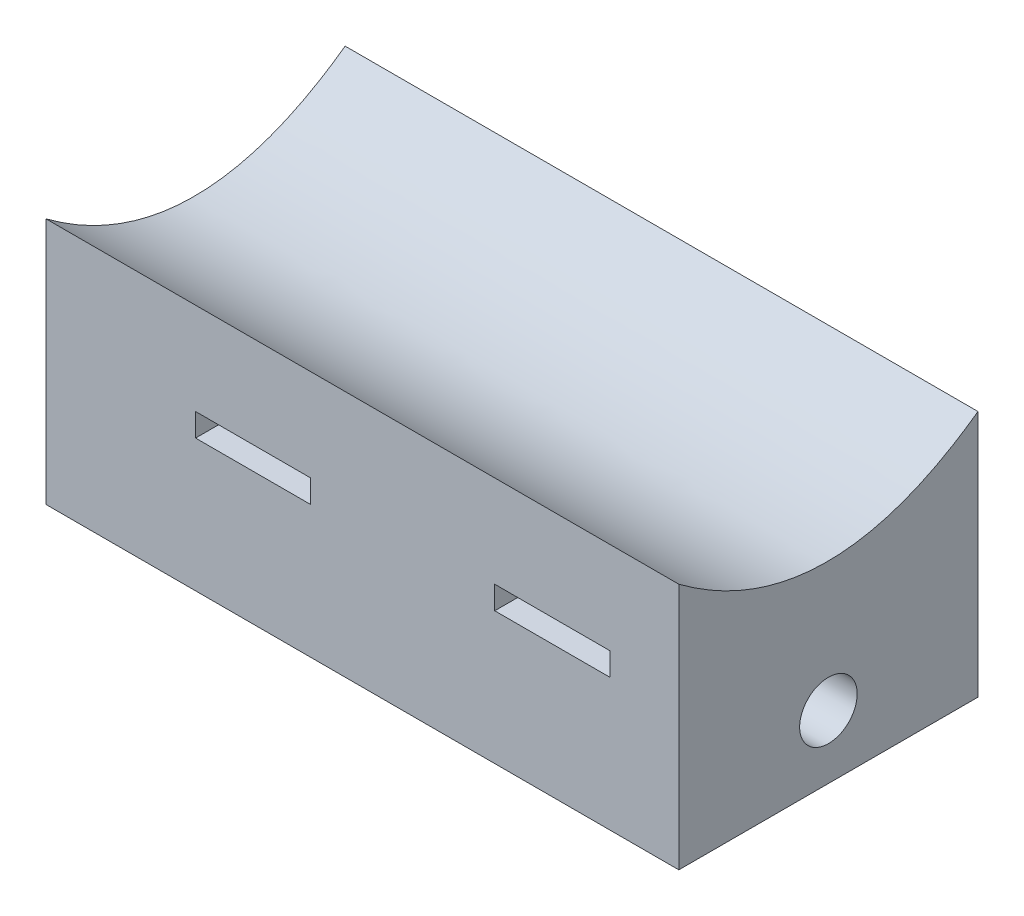
from build123d import *

# Parameters (mm, degrees)
ESQUISSE1_W             = 55
ESQUISSE1_H             = 26
BOSS_EXTRU_1_DEPTH      = 25
ENL_V_MAT_EXTRU_1_REACH = 49.007
ESQUISSE2_W             = 10
ESQUISSE2_H             = 2
ENL_V_MAT_EXTRU_5_REACH = 64.857
ESQUISSE5_R             = 2.5
ESQUISSE5_W             = 26
ESQUISSE5_H             = 3.5


with BuildPart() as part:
    # Esquisse1 → Boss.-Extru.1 (new body)
    with BuildSketch(Plane(origin=(0, 0, 0), x_dir=(1, 0, 0), z_dir=(0, 1, 0))):
        with Locations((2.643338954, -4.351180438)):
            Rectangle(ESQUISSE1_W, ESQUISSE1_H)
    extrude(amount=BOSS_EXTRU_1_DEPTH)

    # Esquisse2 → Enlèv. mat.-Extru.1 (cut, up to next)
    with BuildSketch(Plane.XY.offset(17.351180438), mode=Mode.PRIVATE) as enl_v_mat_extru_1_sk1:
        with Locations((19.143338954, 16)):
            Rectangle(ESQUISSE2_W, ESQUISSE2_H)
    enl_v_mat_extru_1_tool1 = extrude(enl_v_mat_extru_1_sk1.sketch, amount=-ENL_V_MAT_EXTRU_1_REACH, mode=Mode.PRIVATE) & part.part
    # Esquisse2 → Enlèv. mat.-Extru.1 (cut, up to next)
    with BuildSketch(Plane.XY.offset(17.351180438), mode=Mode.PRIVATE) as enl_v_mat_extru_1_sk2:
        with Locations((-6.856661046, 16)):
            Rectangle(ESQUISSE2_W, ESQUISSE2_H)
    enl_v_mat_extru_1_tool2 = extrude(enl_v_mat_extru_1_sk2.sketch, amount=-ENL_V_MAT_EXTRU_1_REACH, mode=Mode.PRIVATE) & part.part
    add(enl_v_mat_extru_1_tool1.solids().sort_by_distance((19.143339, 16, 17.35118))[0], mode=Mode.SUBTRACT)
    add(enl_v_mat_extru_1_tool2.solids().sort_by_distance((-6.856661, 16, 17.35118))[0], mode=Mode.SUBTRACT)

    # Esquisse5 → Enlèv. mat.-Extru.5 (cut, up to next)
    with BuildSketch(Plane(origin=(30.143338954, 0, 0), x_dir=(0, 0, -1), z_dir=(1, 0, 0)), mode=Mode.PRIVATE) as enl_v_mat_extru_5_sk1:
        with Locations((-4.351180438, 9)):
            Circle(ESQUISSE5_R)
    enl_v_mat_extru_5_tool1 = extrude(enl_v_mat_extru_5_sk1.sketch, amount=-ENL_V_MAT_EXTRU_5_REACH, mode=Mode.PRIVATE) & part.part
    # Esquisse5 → Enlèv. mat.-Extru.5 (cut, up to next)
    with BuildSketch(Plane(origin=(30.143338954, 0, 0), x_dir=(0, 0, -1), z_dir=(1, 0, 0)), mode=Mode.PRIVATE) as enl_v_mat_extru_5_sk2:
        with BuildLine():
            Line((-17.351180438, 25), (8.648819562, 25))
            add(Edge.make_bspline(
                [(-17.351180438, 25), (-4.586883511, 15.502643884), (8.648819562, 25)],
                knots=[0, 0, 0, 1, 1, 1], degree=2))
        make_face()
    enl_v_mat_extru_5_tool2 = extrude(enl_v_mat_extru_5_sk2.sketch, amount=-ENL_V_MAT_EXTRU_5_REACH, mode=Mode.PRIVATE) & part.part
    # Esquisse5 → Enlèv. mat.-Extru.5 (cut, up to next)
    with BuildSketch(Plane(origin=(30.143338954, 0, 0), x_dir=(0, 0, -1), z_dir=(1, 0, 0)), mode=Mode.PRIVATE) as enl_v_mat_extru_5_sk3:
        with Locations((-4.351180438, 1.75)):
            Rectangle(ESQUISSE5_W, ESQUISSE5_H)
    enl_v_mat_extru_5_tool3 = extrude(enl_v_mat_extru_5_sk3.sketch, amount=-ENL_V_MAT_EXTRU_5_REACH, mode=Mode.PRIVATE) & part.part
    add(enl_v_mat_extru_5_tool1.solids().sort_by_distance((30.143339, 9, 4.35118))[0], mode=Mode.SUBTRACT)
    add(enl_v_mat_extru_5_tool2.solids().sort_by_distance((30.143339, 23.100529, 4.398321))[0], mode=Mode.SUBTRACT)
    add(enl_v_mat_extru_5_tool3.solids().sort_by_distance((30.143339, 1.75, 4.35118))[0], mode=Mode.SUBTRACT)


solid = part.part
